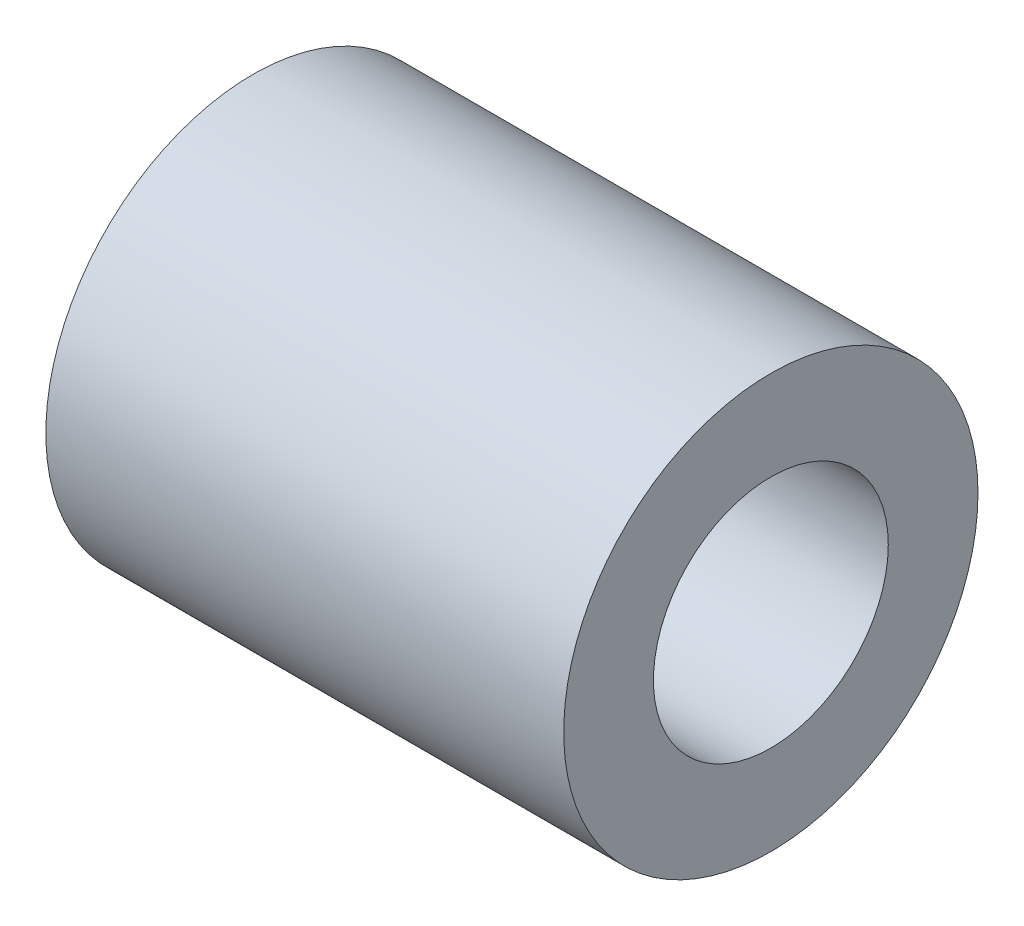
from build123d import *

# Parameters (mm, degrees)
SKETCH1_R           = 3.175
SKETCH1_R_2         = 1.8
BOSS_EXTRUDE1_DEPTH = 7.9375


with BuildPart() as part:
    # Sketch1 → Boss-Extrude1 (new body)
    with BuildSketch(Plane(origin=(0, 0, 0), x_dir=(0, 0, -1), z_dir=(1, 0, 0))):
        Circle(SKETCH1_R)
        Circle(SKETCH1_R_2, mode=Mode.SUBTRACT)
    extrude(amount=BOSS_EXTRUDE1_DEPTH)


solid = part.part
